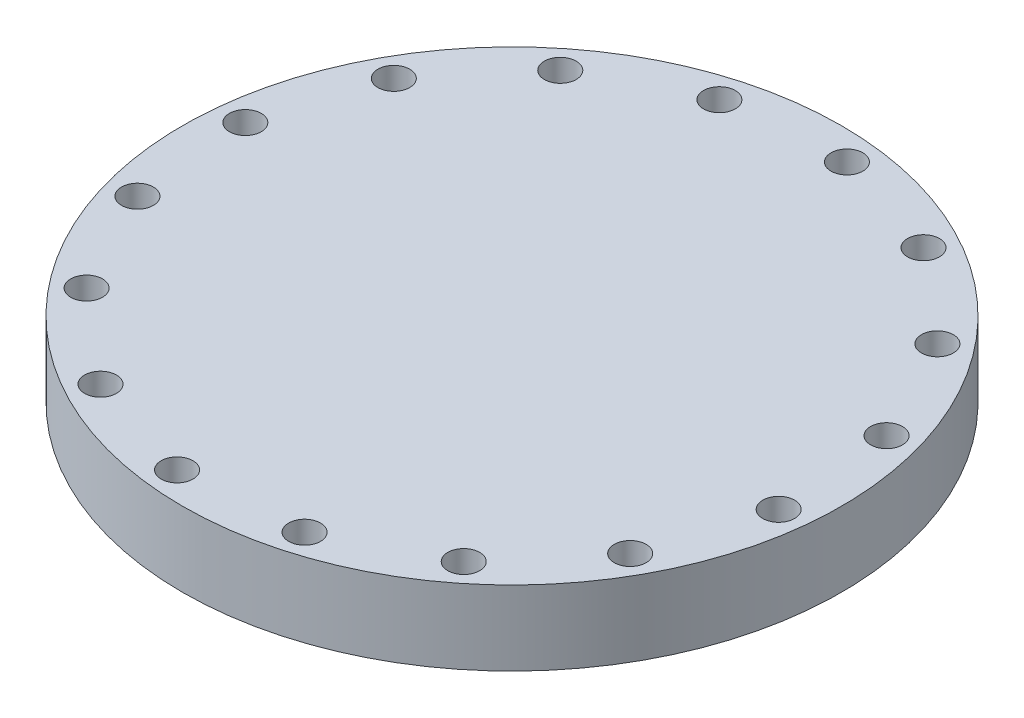
from build123d import *

# Parameters (mm, degrees)
SKETCH1_R           = 25.85370091
BOSS_EXTRUDE1_DEPTH = 2.925
CUT_EXTRUDE1_DEPTH  = 38.02769506


with BuildPart() as part:
    # Sketch1 → Boss-Extrude1 (new, symmetric)
    with BuildSketch(Plane(origin=(0, 0, 0), x_dir=(1, 0, 0), z_dir=(0, 1, 0))):
        with Locations(Location((0, 0, 0), (0, 0, 270))):
            Circle(SKETCH1_R)
    extrude(amount=BOSS_EXTRUDE1_DEPTH, both=True)

    # Sketch2 → Cut-Extrude1 (cut, through all)
    with BuildSketch(Plane.XZ.offset(2.925)):
        with BuildLine():
            ThreePointArc((22.019698731, -5.602620776), (21.872491194, -7.364247848), (23.634118266, -7.511455385))
            ThreePointArc((23.634118266, -7.511455385), (23.781325803, -5.749828313), (22.019698731, -5.602620776))
        make_face()
        with BuildLine():
            ThreePointArc((22.791373624, 3.631983723), (22.644166087, 1.87035665), (24.405793159, 1.723149114))
            ThreePointArc((24.405793159, 1.723149114), (24.553000696, 3.484776186), (22.791373624, 3.631983723))
        make_face()
        with BuildLine():
            ThreePointArc((17.772833946, -13.838975667), (17.625626409, -15.600602739), (19.387253481, -15.747810276))
            ThreePointArc((19.387253481, -15.747810276), (19.534461018, -13.986183203), (17.772833946, -13.838975667))
        make_face()
        with BuildLine():
            ThreePointArc((10.697325934, -19.82317058), (10.550118397, -21.584797652), (12.311745469, -21.732005189))
            ThreePointArc((12.311745469, -21.732005189), (12.458953006, -19.970378117), (10.697325934, -19.82317058))
        make_face()
        with BuildLine():
            ThreePointArc((1.87035665, -22.644166087), (1.723149114, -24.405793159), (3.484776186, -24.553000696))
            ThreePointArc((3.484776186, -24.553000696), (3.631983723, -22.791373624), (1.87035665, -22.644166087))
        make_face()
        with BuildLine():
            ThreePointArc((-7.364247848, -21.872491194), (-7.511455385, -23.634118266), (-5.749828313, -23.781325803))
            ThreePointArc((-5.749828313, -23.781325803), (-5.602620776, -22.019698731), (-7.364247848, -21.872491194))
        make_face()
        with BuildLine():
            ThreePointArc((-15.600602739, -17.625626409), (-15.747810276, -19.387253481), (-13.986183203, -19.534461018))
            ThreePointArc((-13.986183203, -19.534461018), (-13.838975667, -17.772833946), (-15.600602739, -17.625626409))
        make_face()
        with BuildLine():
            ThreePointArc((-21.584797652, -10.550118397), (-21.732005189, -12.311745469), (-19.970378117, -12.458953006))
            ThreePointArc((-19.970378117, -12.458953006), (-19.82317058, -10.697325934), (-21.584797652, -10.550118397))
        make_face()
        with BuildLine():
            ThreePointArc((-24.405793159, -1.723149114), (-24.553000696, -3.484776186), (-22.791373624, -3.631983723))
            ThreePointArc((-22.791373624, -3.631983723), (-22.644166087, -1.87035665), (-24.405793159, -1.723149114))
        make_face()
        with BuildLine():
            ThreePointArc((-23.634118266, 7.511455385), (-23.781325803, 5.749828313), (-22.019698731, 5.602620776))
            ThreePointArc((-22.019698731, 5.602620776), (-21.872491194, 7.364247848), (-23.634118266, 7.511455385))
        make_face()
        with BuildLine():
            ThreePointArc((-19.387253481, 15.747810276), (-19.534461018, 13.986183203), (-17.772833946, 13.838975667))
            ThreePointArc((-17.772833946, 13.838975667), (-17.625626409, 15.600602739), (-19.387253481, 15.747810276))
        make_face()
        with BuildLine():
            ThreePointArc((-12.311745469, 21.732005189), (-12.458953006, 19.970378117), (-10.697325934, 19.82317058))
            ThreePointArc((-10.697325934, 19.82317058), (-10.550118397, 21.584797652), (-12.311745469, 21.732005189))
        make_face()
        with BuildLine():
            ThreePointArc((-3.484776186, 24.553000696), (-3.631983723, 22.791373624), (-1.87035665, 22.644166087))
            ThreePointArc((-1.87035665, 22.644166087), (-1.723149114, 24.405793159), (-3.484776186, 24.553000696))
        make_face()
        with BuildLine():
            ThreePointArc((5.749828313, 23.781325803), (5.602620776, 22.019698731), (7.364247848, 21.872491194))
            ThreePointArc((7.364247848, 21.872491194), (7.511455385, 23.634118266), (5.749828313, 23.781325803))
        make_face()
        with BuildLine():
            ThreePointArc((19.970378117, 12.458953006), (19.82317058, 10.697325934), (21.584797652, 10.550118397))
            ThreePointArc((21.584797652, 10.550118397), (21.732005189, 12.311745469), (19.970378117, 12.458953006))
        make_face()
        with BuildLine():
            ThreePointArc((13.986183203, 19.534461018), (13.838975667, 17.772833946), (15.600602739, 17.625626409))
            ThreePointArc((15.600602739, 17.625626409), (15.747810276, 19.387253481), (13.986183203, 19.534461018))
        make_face()
    extrude(amount=-CUT_EXTRUDE1_DEPTH, mode=Mode.SUBTRACT)


solid = part.part
